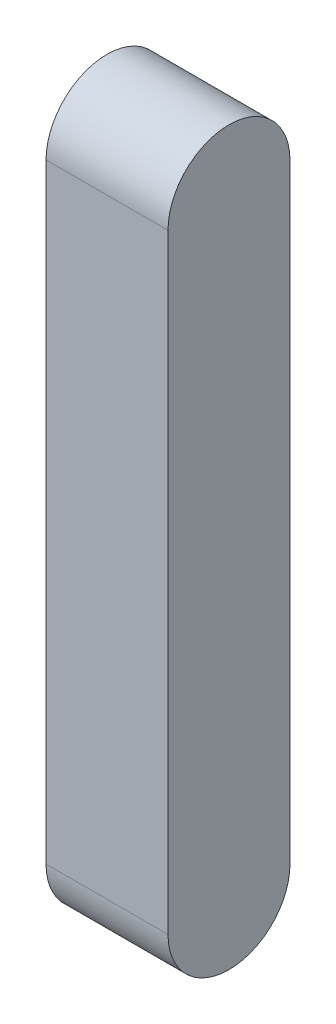
from build123d import *

# Parameters (mm, degrees)
SKETCH_1_R      = 5
SKETCH_1_W      = 10
SKETCH_1_H      = 50
EXTRUDE_1_DEPTH = 10


with BuildPart() as part:
    # 草图1 → 凸台-拉伸1 (new body)
    with BuildSketch(Plane(origin=(0, 0, 0), x_dir=(0, 0, -1), z_dir=(1, 0, 0))):
        with Locations((0, 25)):
            Circle(SKETCH_1_R)
        with Locations((0, -25)):
            Circle(SKETCH_1_R)
        Rectangle(SKETCH_1_W, SKETCH_1_H)
    extrude(amount=EXTRUDE_1_DEPTH)


solid = part.part
